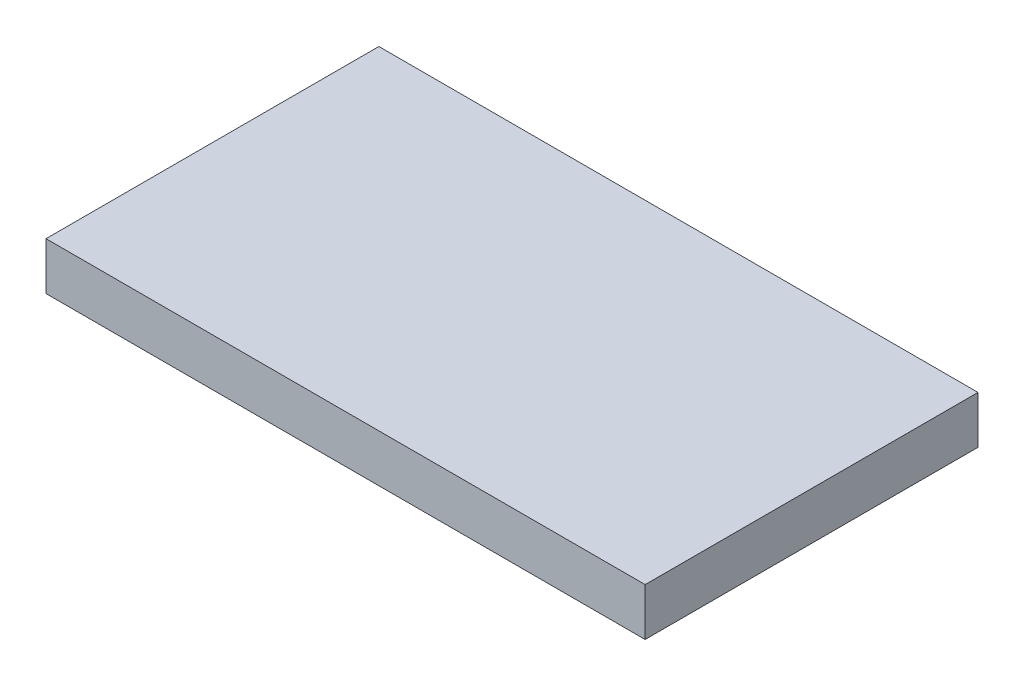
from build123d import *

# Parameters (mm, degrees)
SKETCH1_W           = 63
SKETCH1_H           = 35
BOSS_EXTRUDE1_DEPTH = 5


with BuildPart() as part:
    # Sketch1 → Boss-Extrude1 (new body)
    with BuildSketch(Plane(origin=(0, 0, 0), x_dir=(1, 0, 0), z_dir=(0, 1, 0))):
        with Locations((-20.150953162, 2.819537412)):
            Rectangle(SKETCH1_W, SKETCH1_H)
    extrude(amount=BOSS_EXTRUDE1_DEPTH)


solid = part.part
